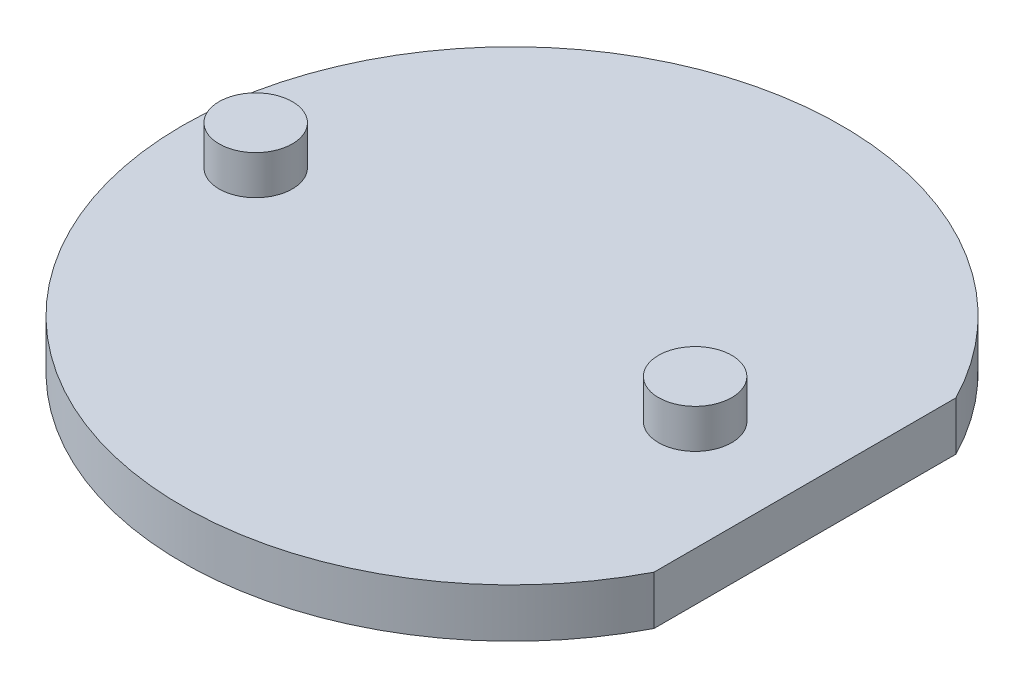
from build123d import *

# Parameters (mm, degrees)
SALIENTE_EXTRUIR1_DEPTH = 2
CROQUIS3_R              = 1.5
SALIENTE_EXTRUIR2_DEPTH = 1.6
CROQUIS4_R              = 2.5
SALIENTE_EXTRUIR3_DEPTH = 2


with BuildPart() as part:
    # Croquis2 → Saliente-Extruir1 (new body)
    with BuildSketch(Plane(origin=(0, 0, 0), x_dir=(1, 0, 0), z_dir=(0, 1, 0))):
        with BuildLine():
            Line((12, 6.184658438), (12, -6.184658438))
            ThreePointArc((12, -6.184658438), (-13.5, 0), (12, 6.184658438))
        make_face()
    extrude(amount=SALIENTE_EXTRUIR1_DEPTH)

    # Croquis3 → Saliente-Extruir2 (add)
    with BuildSketch(Plane(origin=(0, 2, 0), x_dir=(1, 0, 0), z_dir=(0, 1, 0))):
        with Locations(Location((-10.5, 0, 0), (0, 0, 270))):
            Circle(CROQUIS3_R)
        with Locations(Location((7.5, 0, 0), (0, 0, 270))):
            Circle(CROQUIS3_R)
    extrude(amount=SALIENTE_EXTRUIR2_DEPTH)

    # Croquis4 → Saliente-Extruir3 (add)
    with BuildSketch(Plane.XZ):
        with Locations(Location((0, 0, 0), (0, 0, 270))):
            Circle(CROQUIS4_R)
    extrude(amount=SALIENTE_EXTRUIR3_DEPTH)


solid = part.part
